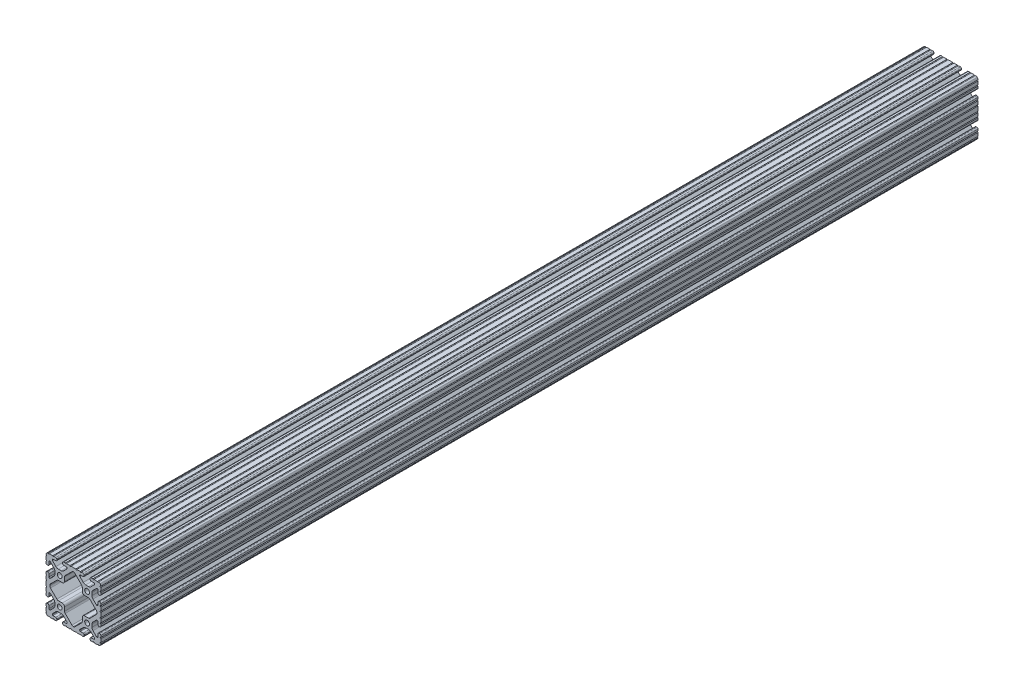
from build123d import *

# Parameters (mm, degrees)
SKETCH1_R           = 3.3274
BOSS_EXTRUDE1_DEPTH = 1219.2


with BuildPart() as part:
    # Sketch1 → Boss-Extrude1 (new body)
    with BuildSketch(Plane(origin=(0, 0, -609.6), x_dir=(-1, 0, 0), z_dir=(0, 0, -1))):
        with BuildLine():
            Line((36.525200182, -23.055396049), (35.610799999, -23.055396049))
            ThreePointArc((35.610799999, -23.055396049), (34.49724824, -23.51664429), (34.035999999, -24.630196049))
            Line((34.035999999, -24.630196049), (34.035999999, -28.448000001))
            ThreePointArc((34.035999999, -28.448000001), (33.775617927, -29.07661793), (33.146999999, -29.337000001))
            Line((33.146999999, -29.337000001), (32.664287243, -29.337000001))
            ThreePointArc((32.664287243, -29.337000001), (32.324081166, -29.269328696), (32.035668541, -29.076617157))
            Line((32.035668541, -29.076617157), (27.197580079, -24.238516795))
            ThreePointArc((27.197580079, -24.238516795), (26.167955878, -22.697572205), (25.806399999, -20.879905136))
            Line((25.806399999, -20.879905136), (25.806399999, -17.220094864))
            ThreePointArc((25.806399999, -17.220094864), (26.167955878, -15.402427795), (27.197580079, -13.861483205))
            Line((27.197580079, -13.861483205), (31.948944539, -9.110107059))
            ThreePointArc((31.948944539, -9.110107059), (32.333417094, -8.853210197), (32.786933647, -8.763000001))
            Line((32.786933647, -8.763000001), (33.060275786, -8.763000001))
            ThreePointArc((33.060275786, -8.763000001), (33.750216993, -9.048783007), (34.035999999, -9.738724214))
            Line((34.035999999, -9.738724214), (34.035999999, -13.469803585))
            ThreePointArc((34.035999999, -13.469803585), (34.497248347, -14.583355602), (35.610800365, -15.044603951))
            Line((35.610800365, -15.044603951), (36.525199999, -15.044603951))
            ThreePointArc((36.525199999, -15.044603951), (37.638751758, -14.58335571), (38.099999999, -13.469803951))
            Line((38.099999999, -13.469803951), (38.099999999, -11.075039291))
            ThreePointArc((38.099999999, -11.075039291), (37.117000249, -10.313517274), (38.099999999, -9.551995256))
            Line((38.099999999, -9.551995256), (38.099999999, -4.723759309))
            ThreePointArc((38.099999999, -4.723759309), (37.117000249, -3.962237291), (38.099999999, -3.200715274))
            Line((38.099999999, -3.200715274), (38.099999999, 3.200715274))
            ThreePointArc((38.099999999, 3.200715274), (37.117000249, 3.962237291), (38.099999999, 4.723759309))
            Line((38.099999999, 4.723759309), (38.099999999, 9.551995254))
            ThreePointArc((38.099999999, 9.551995254), (37.117000249, 10.313517271), (38.099999999, 11.075039288))
            Line((38.099999999, 11.075039288), (38.099999999, 13.469803951))
            ThreePointArc((38.099999999, 13.469803951), (37.638751758, 14.58335571), (36.525199999, 15.044603951))
            Line((36.525199999, 15.044603951), (35.610800365, 15.044603951))
            ThreePointArc((35.610800365, 15.044603951), (34.497248347, 14.583355602), (34.035999999, 13.469803585))
            Line((34.035999999, 13.469803585), (34.035999999, 9.738724211))
            ThreePointArc((34.035999999, 9.738724211), (33.750216993, 9.048783004), (33.060275786, 8.762999999))
            Line((33.060275786, 8.762999999), (32.78693365, 8.762999999))
            ThreePointArc((32.78693365, 8.762999999), (32.333417097, 8.853210195), (31.948944542, 9.110107056))
            Line((31.948944542, 9.110107056), (27.197580079, 13.861483205))
            ThreePointArc((27.197580079, 13.861483205), (26.167955878, 15.402427795), (25.806399999, 17.220094864))
            Line((25.806399999, 17.220094864), (25.806399999, 20.879905136))
            ThreePointArc((25.806399999, 20.879905136), (26.167955878, 22.697572205), (27.19758008, 24.238516796))
            Line((27.19758008, 24.238516796), (32.035668541, 29.076617154))
            ThreePointArc((32.035668541, 29.076617154), (32.324081166, 29.269328694), (32.664287243, 29.336999999))
            Line((32.664287243, 29.336999999), (33.146999999, 29.336999999))
            ThreePointArc((33.146999999, 29.336999999), (33.775617927, 29.076617927), (34.035999999, 28.447999999))
            Line((34.035999999, 28.447999999), (34.035999999, 24.630196049))
            ThreePointArc((34.035999999, 24.630196049), (34.49724824, 23.51664429), (35.610799999, 23.055396049))
            Line((35.610799999, 23.055396049), (36.525200182, 23.055396049))
            ThreePointArc((36.525200182, 23.055396049), (37.638751811, 23.516644237), (38.099999999, 24.630195866))
            Line((38.099999999, 24.630195866), (38.099999999, 27.023826138))
            ThreePointArc((38.099999999, 27.023826138), (37.117780707, 27.7845421), (38.099999999, 28.545258063))
            Line((38.099999999, 28.545258063), (38.099999999, 33.373016026))
            ThreePointArc((38.099999999, 33.373016026), (37.141472622, 34.109236775), (38.1, 34.845457522))
            ThreePointArc((38.1, 34.845457522), (37.837757798, 36.120195039), (37.086123087, 37.182631848))
            ThreePointArc((37.086123087, 37.182631848), (36.106286535, 37.843374412), (34.952681874, 38.099999999))
            ThreePointArc((34.952681874, 38.099999999), (34.190730434, 37.320215334), (33.428778993, 38.099999999))
            Line((33.428778993, 38.099999999), (28.601105934, 38.099999999))
            ThreePointArc((28.601105934, 38.099999999), (27.83915858, 37.320219419), (27.077211226, 38.099999999))
            Line((27.077211226, 38.099999999), (24.688799999, 38.099999999))
            ThreePointArc((24.688799999, 38.099999999), (23.57524824, 37.638751758), (23.113999999, 36.525199999))
            Line((23.113999999, 36.525199999), (23.113999999, 35.610799999))
            ThreePointArc((23.113999999, 35.610799999), (23.57524824, 34.49724824), (24.688799999, 34.035999999))
            Line((24.688799999, 34.035999999), (28.447999999, 34.035999999))
            ThreePointArc((28.447999999, 34.035999999), (29.076617927, 33.775617927), (29.336999999, 33.146999999))
            Line((29.336999999, 33.146999999), (29.336999999, 32.720693457))
            ThreePointArc((29.336999999, 32.720693457), (29.326675076, 32.273872753), (29.100231244, 31.888543625))
            Line((29.100231244, 31.888543625), (24.409287498, 27.19758834))
            ThreePointArc((24.409287498, 27.19758834), (22.868340044, 26.167958113), (21.050667578, 25.806399999))
            Line((21.050667578, 25.806399999), (17.049332422, 25.806399999))
            ThreePointArc((17.049332422, 25.806399999), (15.231659956, 26.167958113), (13.690712502, 27.19758834))
            Line((13.690712502, 27.19758834), (9.023381297, 31.864931026))
            ThreePointArc((9.023381297, 31.864931026), (8.830670885, 32.153343115), (8.762999999, 32.493548181))
            Line((8.762999999, 32.493548181), (8.762999999, 33.146999999))
            ThreePointArc((8.762999999, 33.146999999), (9.02338207, 33.775617927), (9.651999999, 34.035999999))
            Line((9.651999999, 34.035999999), (13.411199999, 34.035999999))
            ThreePointArc((13.411199999, 34.035999999), (14.524751758, 34.49724824), (14.985999999, 35.610799999))
            Line((14.985999999, 35.610799999), (14.985999999, 36.525199999))
            ThreePointArc((14.985999999, 36.525199999), (14.524751758, 37.638751758), (13.411199999, 38.099999999))
            Line((13.411199999, 38.099999999), (11.128867073, 38.099999999))
            ThreePointArc((11.128867073, 38.099999999), (10.367071032, 37.320370692), (9.605274992, 38.099999999))
            Line((9.605274992, 38.099999999), (4.777313068, 38.099999999))
            ThreePointArc((4.777313068, 38.099999999), (4.015517027, 37.320370692), (3.253720987, 38.099999999))
            Line((3.253720987, 38.099999999), (-3.253720989, 38.099999999))
            ThreePointArc((-3.253720989, 38.099999999), (-4.01551703, 37.320370692), (-4.777313071, 38.099999999))
            Line((-4.777313071, 38.099999999), (-9.605274992, 38.099999999))
            ThreePointArc((-9.605274992, 38.099999999), (-10.367071032, 37.320370692), (-11.128867073, 38.099999999))
            Line((-11.128867073, 38.099999999), (-13.411200001, 38.099999999))
            ThreePointArc((-13.411200001, 38.099999999), (-14.52475176, 37.638751758), (-14.986000001, 36.525199999))
            Line((-14.986000001, 36.525199999), (-14.986000001, 35.610799999))
            ThreePointArc((-14.986000001, 35.610799999), (-14.52475176, 34.49724824), (-13.411200001, 34.035999999))
            Line((-13.411200001, 34.035999999), (-9.652000001, 34.035999999))
            ThreePointArc((-9.652000001, 34.035999999), (-9.023382073, 33.775617927), (-8.763000001, 33.146999999))
            Line((-8.763000001, 33.146999999), (-8.763000001, 32.493548178))
            ThreePointArc((-8.763000001, 32.493548178), (-8.830670888, 32.153343112), (-9.0233813, 31.864931023))
            Line((-9.0233813, 31.864931023), (-13.690712502, 27.19758834))
            ThreePointArc((-13.690712502, 27.19758834), (-15.231659956, 26.167958113), (-17.049332422, 25.806399999))
            Line((-17.049332422, 25.806399999), (-21.050667578, 25.806399999))
            ThreePointArc((-21.050667578, 25.806399999), (-22.868340044, 26.167958113), (-24.409287498, 27.19758834))
            Line((-24.409287498, 27.19758834), (-29.100231244, 31.888543625))
            ThreePointArc((-29.100231244, 31.888543625), (-29.326675074, 32.273872748), (-29.337000001, 32.720693446))
            Line((-29.337000001, 32.720693446), (-29.337000001, 33.146999999))
            ThreePointArc((-29.337000001, 33.146999999), (-29.07661793, 33.775617927), (-28.448000001, 34.035999999))
            Line((-28.448000001, 34.035999999), (-24.688800001, 34.035999999))
            ThreePointArc((-24.688800001, 34.035999999), (-23.575248242, 34.49724824), (-23.114000001, 35.610799999))
            Line((-23.114000001, 35.610799999), (-23.114000001, 36.525199999))
            ThreePointArc((-23.114000001, 36.525199999), (-23.575248242, 37.638751758), (-24.688800001, 38.099999999))
            Line((-24.688800001, 38.099999999), (-27.077211226, 38.099999999))
            ThreePointArc((-27.077211226, 38.099999999), (-27.83915858, 37.320219419), (-28.601105934, 38.099999999))
            Line((-28.601105934, 38.099999999), (-33.428778993, 38.099999999))
            ThreePointArc((-33.428778993, 38.099999999), (-34.190730434, 37.320215334), (-34.952681874, 38.099999999))
            ThreePointArc((-34.952681874, 38.099999999), (-36.106286561, 37.843374402), (-37.086123128, 37.18263181))
            ThreePointArc((-37.086123128, 37.18263181), (-37.837757809, 36.120195013), (-38.1, 34.845457522))
            ThreePointArc((-38.1, 34.845457522), (-37.141472622, 34.109236773), (-38.100000001, 33.373016026))
            Line((-38.100000001, 33.373016026), (-38.100000001, 28.545258062))
            ThreePointArc((-38.100000001, 28.545258062), (-37.117780707, 27.7845421), (-38.100000001, 27.023826138))
            Line((-38.100000001, 27.023826138), (-38.100000001, 24.630195866))
            ThreePointArc((-38.100000001, 24.630195866), (-37.638751814, 23.516644237), (-36.525200184, 23.055396049))
            Line((-36.525200184, 23.055396049), (-35.610800001, 23.055396049))
            ThreePointArc((-35.610800001, 23.055396049), (-34.497248242, 23.51664429), (-34.036000001, 24.630196049))
            Line((-34.036000001, 24.630196049), (-34.036000001, 28.447999999))
            ThreePointArc((-34.036000001, 28.447999999), (-33.77561793, 29.076617927), (-33.147000001, 29.336999999))
            Line((-33.147000001, 29.336999999), (-32.664287243, 29.336999999))
            ThreePointArc((-32.664287243, 29.336999999), (-32.324081166, 29.269328694), (-32.035668541, 29.076617154))
            Line((-32.035668541, 29.076617154), (-27.197580082, 24.238516798))
            ThreePointArc((-27.197580082, 24.238516798), (-26.16795588, 22.697572208), (-25.806400001, 20.879905138))
            Line((-25.806400001, 20.879905138), (-25.806400001, 17.220094862))
            ThreePointArc((-25.806400001, 17.220094862), (-26.16795588, 15.402427793), (-27.197580082, 13.861483203))
            Line((-27.197580082, 13.861483203), (-31.948944542, 9.110107056))
            ThreePointArc((-31.948944542, 9.110107056), (-32.333417097, 8.853210195), (-32.78693365, 8.762999999))
            Line((-32.78693365, 8.762999999), (-33.060275789, 8.762999999))
            ThreePointArc((-33.060275789, 8.762999999), (-33.750216996, 9.048783004), (-34.036000001, 9.738724211))
            Line((-34.036000001, 9.738724211), (-34.036000001, 13.469803585))
            ThreePointArc((-34.036000001, 13.469803585), (-34.497248349, 14.583355602), (-35.610800367, 15.044603951))
            Line((-35.610800367, 15.044603951), (-36.525200001, 15.044603951))
            ThreePointArc((-36.525200001, 15.044603951), (-37.63875176, 14.58335571), (-38.100000001, 13.469803951))
            Line((-38.100000001, 13.469803951), (-38.100000001, 11.075039288))
            ThreePointArc((-38.100000001, 11.075039288), (-37.117000249, 10.313517271), (-38.100000001, 9.551995254))
            Line((-38.100000001, 9.551995254), (-38.100000001, 4.723759308))
            ThreePointArc((-38.100000001, 4.723759308), (-37.117000249, 3.962237291), (-38.100000001, 3.200715275))
            Line((-38.100000001, 3.200715275), (-38.100000001, -3.200715275))
            ThreePointArc((-38.100000001, -3.200715275), (-37.117000249, -3.962237291), (-38.100000001, -4.723759308))
            Line((-38.100000001, -4.723759308), (-38.100000001, -9.551995257))
            ThreePointArc((-38.100000001, -9.551995257), (-37.117000249, -10.313517274), (-38.100000001, -11.07503929))
            Line((-38.100000001, -11.07503929), (-38.100000001, -13.469803951))
            ThreePointArc((-38.100000001, -13.469803951), (-37.63875176, -14.58335571), (-36.525200001, -15.044603951))
            Line((-36.525200001, -15.044603951), (-35.610800367, -15.044603951))
            ThreePointArc((-35.610800367, -15.044603951), (-34.497248349, -14.583355602), (-34.036000001, -13.469803585))
            Line((-34.036000001, -13.469803585), (-34.036000001, -9.738724214))
            ThreePointArc((-34.036000001, -9.738724214), (-33.750216996, -9.048783007), (-33.060275789, -8.763000001))
            Line((-33.060275789, -8.763000001), (-32.786933647, -8.763000001))
            ThreePointArc((-32.786933647, -8.763000001), (-32.333417094, -8.853210197), (-31.948944539, -9.110107059))
            Line((-31.948944539, -9.110107059), (-27.197580082, -13.861483203))
            ThreePointArc((-27.197580082, -13.861483203), (-26.16795588, -15.402427793), (-25.806400001, -17.220094862))
            Line((-25.806400001, -17.220094862), (-25.806400001, -20.879905138))
            ThreePointArc((-25.806400001, -20.879905138), (-26.16795588, -22.697572207), (-27.197580082, -24.238516797))
            Line((-27.197580082, -24.238516797), (-32.035668541, -29.076617157))
            ThreePointArc((-32.035668541, -29.076617157), (-32.324081166, -29.269328696), (-32.664287243, -29.337000001))
            Line((-32.664287243, -29.337000001), (-33.147000001, -29.337000001))
            ThreePointArc((-33.147000001, -29.337000001), (-33.77561793, -29.07661793), (-34.036000001, -28.448000001))
            Line((-34.036000001, -28.448000001), (-34.036000001, -24.630196049))
            ThreePointArc((-34.036000001, -24.630196049), (-34.497248242, -23.51664429), (-35.610800001, -23.055396049))
            Line((-35.610800001, -23.055396049), (-36.525200184, -23.055396049))
            ThreePointArc((-36.525200184, -23.055396049), (-37.638751814, -23.516644237), (-38.100000001, -24.630195866))
            Line((-38.100000001, -24.630195866), (-38.100000001, -27.023826138))
            ThreePointArc((-38.100000001, -27.023826138), (-37.117780707, -27.7845421), (-38.100000001, -28.545258062))
            Line((-38.100000001, -28.545258062), (-38.100000001, -33.373016026))
            ThreePointArc((-38.100000001, -33.373016026), (-37.141472622, -34.109236773), (-38.1, -34.845457522))
            ThreePointArc((-38.1, -34.845457522), (-37.83775782, -36.120194987), (-37.086123169, -37.182631771))
            ThreePointArc((-37.086123169, -37.182631771), (-36.106286588, -37.843374393), (-34.952681874, -38.100000001))
            ThreePointArc((-34.952681874, -38.100000001), (-34.190730434, -37.320215336), (-33.428778993, -38.100000001))
            Line((-33.428778993, -38.100000001), (-28.601105934, -38.100000001))
            ThreePointArc((-28.601105934, -38.100000001), (-27.83915858, -37.320219421), (-27.077211226, -38.100000001))
            Line((-27.077211226, -38.100000001), (-24.688800001, -38.100000001))
            ThreePointArc((-24.688800001, -38.100000001), (-23.575248242, -37.63875176), (-23.114000001, -36.525200001))
            Line((-23.114000001, -36.525200001), (-23.114000001, -35.610800001))
            ThreePointArc((-23.114000001, -35.610800001), (-23.575248242, -34.497248242), (-24.688800001, -34.036000001))
            Line((-24.688800001, -34.036000001), (-28.448000001, -34.036000001))
            ThreePointArc((-28.448000001, -34.036000001), (-29.07661793, -33.77561793), (-29.337000001, -33.147000001))
            Line((-29.337000001, -33.147000001), (-29.337000001, -32.720693446))
            ThreePointArc((-29.337000001, -32.720693446), (-29.326675074, -32.273872748), (-29.100231244, -31.888543625))
            Line((-29.100231244, -31.888543625), (-24.409287501, -27.197588343))
            ThreePointArc((-24.409287501, -27.197588343), (-22.868340046, -26.167958116), (-21.050667581, -25.806400001))
            Line((-21.050667581, -25.806400001), (-17.049332419, -25.806400001))
            ThreePointArc((-17.049332419, -25.806400001), (-15.231659954, -26.167958116), (-13.690712499, -27.197588343))
            Line((-13.690712499, -27.197588343), (-9.0233813, -31.864931023))
            ThreePointArc((-9.0233813, -31.864931023), (-8.830670888, -32.153343112), (-8.763000001, -32.493548178))
            Line((-8.763000001, -32.493548178), (-8.763000001, -33.147000001))
            ThreePointArc((-8.763000001, -33.147000001), (-9.023382073, -33.77561793), (-9.652000001, -34.036000001))
            Line((-9.652000001, -34.036000001), (-13.411200001, -34.036000001))
            ThreePointArc((-13.411200001, -34.036000001), (-14.52475176, -34.497248242), (-14.986000001, -35.610800001))
            Line((-14.986000001, -35.610800001), (-14.986000001, -36.525200001))
            ThreePointArc((-14.986000001, -36.525200001), (-14.52475176, -37.63875176), (-13.411200001, -38.100000001))
            Line((-13.411200001, -38.100000001), (-11.128867073, -38.100000001))
            ThreePointArc((-11.128867073, -38.100000001), (-10.367071032, -37.320370694), (-9.605274992, -38.100000001))
            Line((-9.605274992, -38.100000001), (-4.777313071, -38.100000001))
            ThreePointArc((-4.777313071, -38.100000001), (-4.01551703, -37.320370694), (-3.253720989, -38.100000001))
            Line((-3.253720989, -38.100000001), (3.253720987, -38.100000001))
            ThreePointArc((3.253720987, -38.100000001), (4.015517027, -37.320370694), (4.777313068, -38.100000001))
            Line((4.777313068, -38.100000001), (9.605274992, -38.100000001))
            ThreePointArc((9.605274992, -38.100000001), (10.367071032, -37.320370694), (11.128867073, -38.100000001))
            Line((11.128867073, -38.100000001), (13.411199999, -38.100000001))
            ThreePointArc((13.411199999, -38.100000001), (14.524751758, -37.63875176), (14.985999999, -36.525200001))
            Line((14.985999999, -36.525200001), (14.985999999, -35.610800001))
            ThreePointArc((14.985999999, -35.610800001), (14.524751758, -34.497248242), (13.411199999, -34.036000001))
            Line((13.411199999, -34.036000001), (9.651999999, -34.036000001))
            ThreePointArc((9.651999999, -34.036000001), (9.02338207, -33.77561793), (8.762999999, -33.147000001))
            Line((8.762999999, -33.147000001), (8.762999999, -32.493548181))
            ThreePointArc((8.762999999, -32.493548181), (8.830670885, -32.153343115), (9.023381297, -31.864931026))
            Line((9.023381297, -31.864931026), (13.690712499, -27.197588343))
            ThreePointArc((13.690712499, -27.197588343), (15.231659954, -26.167958116), (17.049332419, -25.806400001))
            Line((17.049332419, -25.806400001), (21.050667581, -25.806400001))
            ThreePointArc((21.050667581, -25.806400001), (22.868340046, -26.167958116), (24.409287501, -27.197588343))
            Line((24.409287501, -27.197588343), (29.100231244, -31.888543625))
            ThreePointArc((29.100231244, -31.888543625), (29.326675076, -32.273872753), (29.336999999, -32.720693457))
            Line((29.336999999, -32.720693457), (29.336999999, -33.147000001))
            ThreePointArc((29.336999999, -33.147000001), (29.076617927, -33.77561793), (28.447999999, -34.036000001))
            Line((28.447999999, -34.036000001), (24.688799999, -34.036000001))
            ThreePointArc((24.688799999, -34.036000001), (23.57524824, -34.497248242), (23.113999999, -35.610800001))
            Line((23.113999999, -35.610800001), (23.113999999, -36.525200001))
            ThreePointArc((23.113999999, -36.525200001), (23.57524824, -37.63875176), (24.688799999, -38.100000001))
            Line((24.688799999, -38.100000001), (27.077211226, -38.100000001))
            ThreePointArc((27.077211226, -38.100000001), (27.83915858, -37.320219421), (28.601105934, -38.100000001))
            Line((28.601105934, -38.100000001), (33.428778993, -38.100000001))
            ThreePointArc((33.428778993, -38.100000001), (34.190730434, -37.320215336), (34.952681874, -38.100000001))
            ThreePointArc((34.952681874, -38.100000001), (36.106286561, -37.843374403), (37.086123128, -37.182631809))
            ThreePointArc((37.086123128, -37.182631809), (37.837757809, -36.120195013), (38.1, -34.845457522))
            ThreePointArc((38.1, -34.845457522), (37.141472622, -34.109236775), (38.099999999, -33.373016026))
            Line((38.099999999, -33.373016026), (38.099999999, -28.545258063))
            ThreePointArc((38.099999999, -28.545258063), (37.117780707, -27.7845421), (38.099999999, -27.023826138))
            Line((38.099999999, -27.023826138), (38.099999999, -24.630195866))
            ThreePointArc((38.099999999, -24.630195866), (37.638751811, -23.516644237), (36.525200182, -23.055396049))
        make_face()
        with Locations((19.049999999, -19.050000001)):
            Circle(SKETCH1_R, mode=Mode.SUBTRACT)
        with Locations((19.049999999, 19.049999999)):
            Circle(SKETCH1_R, mode=Mode.SUBTRACT)
        with Locations((-19.050000001, 19.049999999)):
            Circle(SKETCH1_R, mode=Mode.SUBTRACT)
        with Locations((-19.050000001, -19.050000001)):
            Circle(SKETCH1_R, mode=Mode.SUBTRACT)
        with BuildLine():
            Line((31.902125566, -2.475607376), (23.014093535, -11.36366127))
            ThreePointArc((23.014093535, -11.36366127), (21.984048445, -12.05191677), (20.769026744, -12.293600001))
            Line((20.769026744, -12.293600001), (15.468599999, -12.293600001))
            ThreePointArc((15.468599999, -12.293600001), (13.223535968, -13.223535971), (12.293599999, -15.468600001))
            Line((12.293599999, -15.468600001), (12.293599999, -20.598259734))
            ThreePointArc((12.293599999, -20.598259734), (12.051918262, -21.813277828), (11.36366679, -22.843321004))
            Line((11.36366679, -22.843321004), (2.051515951, -32.155494748))
            ThreePointArc((2.051515951, -32.155494748), (1.11031328, -32.786013752), (0, -33.011005091))
            ThreePointArc((0, -33.011005091), (-1.11031328, -32.786013752), (-2.051515951, -32.155494748))
            Line((-2.051515951, -32.155494748), (-11.363666793, -22.843321001))
            ThreePointArc((-11.363666793, -22.843321001), (-12.051918264, -21.813277826), (-12.293600001, -20.598259732))
            Line((-12.293600001, -20.598259732), (-12.293600001, -15.468600001))
            ThreePointArc((-12.293600001, -15.468600001), (-13.223535971, -13.223535971), (-15.468600001, -12.293600001))
            Line((-15.468600001, -12.293600001), (-20.769026744, -12.293600001))
            ThreePointArc((-20.769026744, -12.293600001), (-21.984048445, -12.05191677), (-23.014093535, -11.36366127))
            Line((-23.014093535, -11.36366127), (-31.902125566, -2.475607376))
            ThreePointArc((-31.902125566, -2.475607376), (-32.607298578, -1.335259481), (-32.728725173, 0))
            ThreePointArc((-32.728725173, 0), (-32.607298578, 1.335259481), (-31.902125566, 2.475607376))
            Line((-31.902125566, 2.475607376), (-23.014093538, 11.363661268))
            ThreePointArc((-23.014093538, 11.363661268), (-21.984048448, 12.051916767), (-20.769026746, 12.293599999))
            Line((-20.769026746, 12.293599999), (-15.468600001, 12.293599999))
            ThreePointArc((-15.468600001, 12.293599999), (-13.223535971, 13.223535968), (-12.293600001, 15.468599999))
            Line((-12.293600001, 15.468599999), (-12.293600001, 20.598259732))
            ThreePointArc((-12.293600001, 20.598259732), (-12.051918264, 21.813277826), (-11.363666793, 22.843321001))
            Line((-11.363666793, 22.843321001), (-2.051515951, 32.155494748))
            ThreePointArc((-2.051515951, 32.155494748), (-1.11031328, 32.786013752), (0, 33.011005091))
            ThreePointArc((0, 33.011005091), (1.11031328, 32.786013752), (2.051515951, 32.155494748))
            Line((2.051515951, 32.155494748), (11.36366679, 22.843321004))
            ThreePointArc((11.36366679, 22.843321004), (12.051918262, 21.813277828), (12.293599999, 20.598259734))
            Line((12.293599999, 20.598259734), (12.293599999, 15.468599999))
            ThreePointArc((12.293599999, 15.468599999), (13.223535968, 13.223535968), (15.468599999, 12.293599999))
            Line((15.468599999, 12.293599999), (20.769026746, 12.293599999))
            ThreePointArc((20.769026746, 12.293599999), (21.984048448, 12.051916767), (23.014093538, 11.363661268))
            Line((23.014093538, 11.363661268), (31.902125566, 2.475607376))
            ThreePointArc((31.902125566, 2.475607376), (32.607298578, 1.335259481), (32.728725173, 0))
            ThreePointArc((32.728725173, 0), (32.607298578, -1.335259481), (31.902125566, -2.475607376))
        make_face(mode=Mode.SUBTRACT)
    extrude(amount=-BOSS_EXTRUDE1_DEPTH)


solid = part.part
